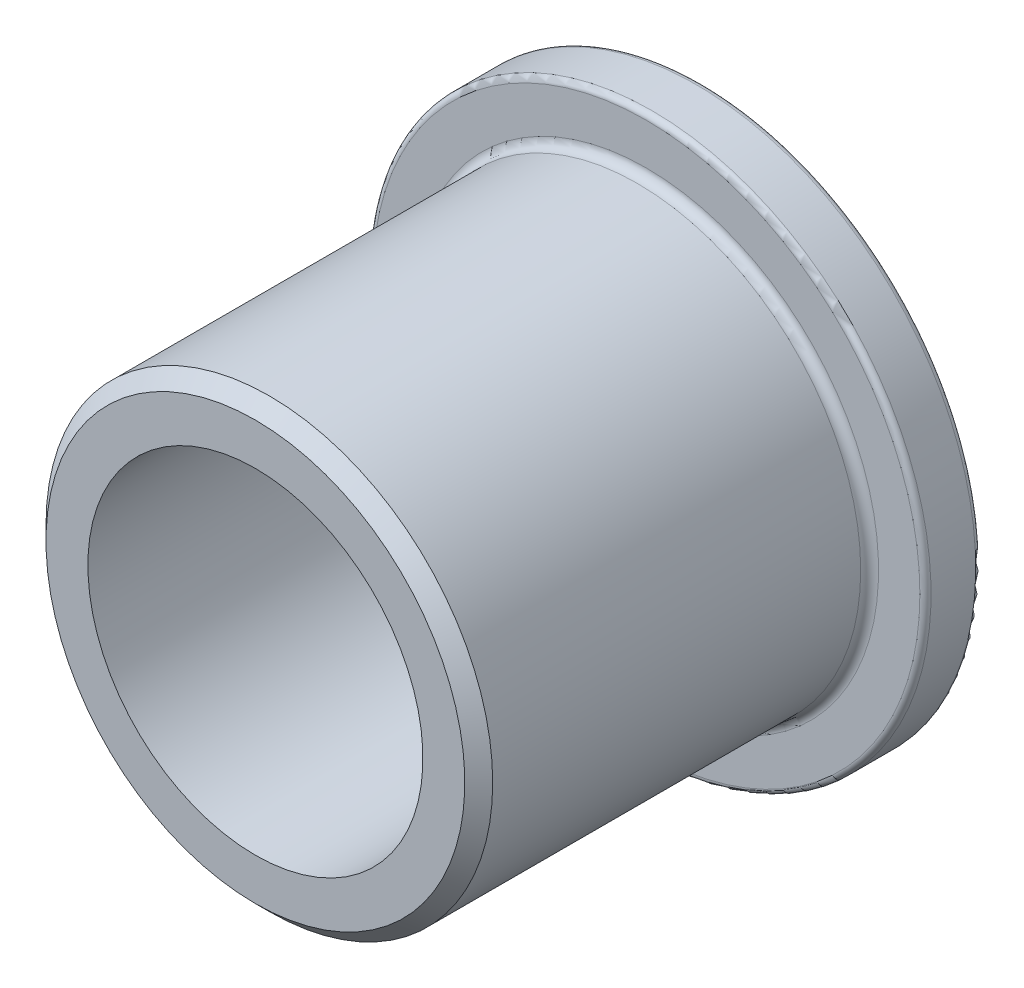
from build123d import *

# Parameters (mm, degrees)
CHAMFER1_SIZE = 0.396875
FILLET1_R     = 0.254
FILLET2_R     = 0.15875
CHAMFER2_SIZE = 0.47625


with BuildPart() as part:
    # Sketch3 → Revolve1 (revolve)
    with BuildSketch(Plane(origin=(0, 0, 0), x_dir=(0, 0, -1), z_dir=(1, 0, 0)), mode=Mode.PRIVATE) as revolve1_sk:
        Polygon((-6.35, 4.7625), (6.35, 4.7625), (6.35, 7.9375), (4.7625, 7.9375), (4.7625, 6.35), (-6.35, 6.35), align=None)
    revolve(revolve1_sk.sketch.rotate(Axis((0, 0, 6.35), (0, 0, -1)), 180), axis=Axis((0, 0, 6.35), (0, 0, -1)))

    # Chamfer1
    chamfer1_edges = [part.edges().sort_by_distance(p)[0] for p in [
        (0, 6.35, 6.35),
    ]]
    chamfer(chamfer1_edges, length=CHAMFER1_SIZE)

    # Fillet1
    fillet1_edges = [part.edges().sort_by_distance(p)[0] for p in [
        (0, 6.35, -4.7625),
    ]]
    fillet(fillet1_edges, radius=FILLET1_R)

    # Fillet2
    fillet2_edges = [part.edges().sort_by_distance(p)[0] for p in [
        (0, 7.9375, -4.7625),
        (0, 7.9375, -6.35),
    ]]
    fillet(fillet2_edges, radius=FILLET2_R)

    # Chamfer2
    chamfer2_edges = [part.edges().sort_by_distance(p)[0] for p in [
        (0, 4.7625, -6.35),
    ]]
    chamfer(chamfer2_edges, length=CHAMFER2_SIZE)


solid = part.part
